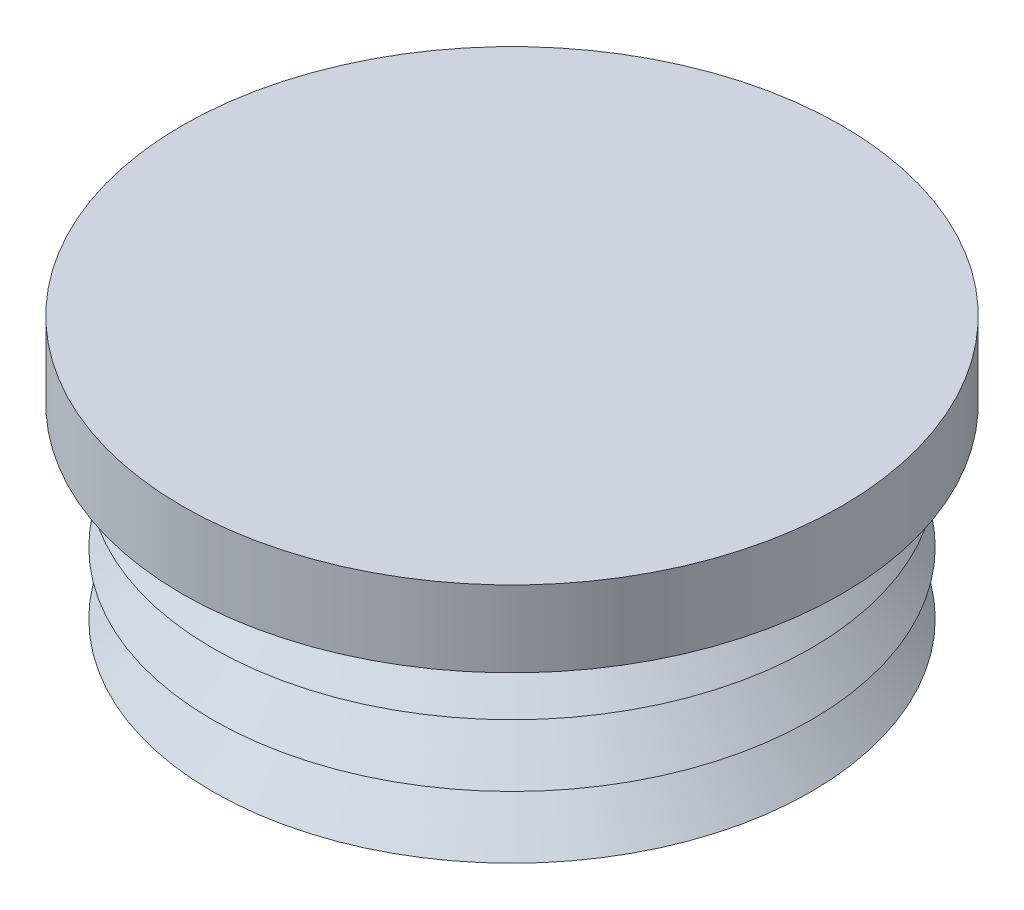
from build123d import *


with BuildPart() as part:
    # Sketch1 → Revolve1 (revolve)
    with BuildSketch(Plane.XY, mode=Mode.PRIVATE) as revolve1_sk:
        Polygon((15.875, 0), (15.875, 1.031875), (18.7325, 1.031875), (15.875, 3.889375), (15.875, 4.92125), (18.7325, 4.92125), (15.875, 7.77875), (15.875, 8.810625), (18.7325, 8.810625), (15.875, 11.668125), (15.875, 12.7), (20.6375, 12.7), (20.6375, 17.4625), (0, 17.4625), (0, 12.7), (14.9225, 12.7), (14.9225, 0), align=None)
    revolve(revolve1_sk.sketch.rotate(Axis((0, 0, 0), (0, 1, 0)), 90), axis=Axis((0, 0, 0), (0, 1, 0)))


solid = part.part
